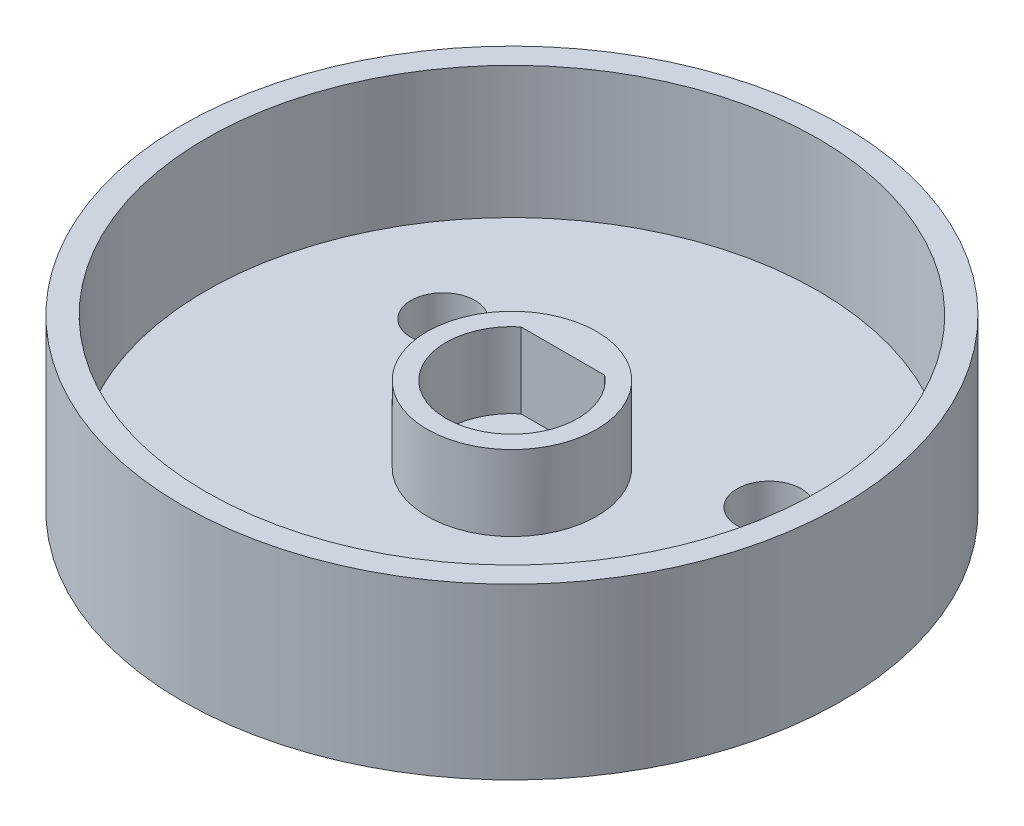
from build123d import *

# Parameters (mm, degrees)
BOSS_EXTRUDE1_DEPTH = 150
SKETCH2_R           = 35
SKETCH2_R_2         = 32.5
BOSS_EXTRUDE2_DEPTH = 14
SKETCH3_R           = 9
BOSS_EXTRUDE3_DEPTH = 8
SKETCH5_R           = 3.4
CUT_EXTRUDE1_DEPTH  = 14
CUT_EXTRUDE4_DEPTH  = 154
CUT_EXTRUDE6_START  = -4
CUT_EXTRUDE6_DEPTH  = 4
CUT_EXTRUDE7_START  = -4
CUT_EXTRUDE7_DEPTH  = 4
SKETCH13_R          = 3.4
CUT_EXTRUDE8_DEPTH  = 10
CIRPATTERN1_COUNT   = 3


with BuildPart() as part:
    # Sketch1 → Boss-Extrude1 (new body)
    with BuildSketch(Plane.YZ):
        Polygon((-60, -45), (-60, 45), (60, 45), (60, -45), (56, -45), (56, 41), (-56, 41), (-56, -45), align=None)
    extrude(amount=BOSS_EXTRUDE1_DEPTH)

    # Sketch2 → Boss-Extrude2 (add)
    with BuildSketch(Plane(origin=(0, 60, 0), x_dir=(-1, 0, 0), z_dir=(0, 1, 0))):
        with Locations(Location((-105.539679059, 0.129309752, 0), (0, 0, 270))):
            Circle(SKETCH2_R)
        with Locations(Location((-105.539679059, 0.129309752, 0), (0, 0, 90))):
            Circle(SKETCH2_R_2, mode=Mode.SUBTRACT)
    extrude(amount=BOSS_EXTRUDE2_DEPTH)

    # Sketch3 → Boss-Extrude3 (add)
    with BuildSketch(Plane(origin=(0, 60, 0), x_dir=(-1, 0, 0), z_dir=(0, 1, 0))):
        with Locations(Location((-105.539679059, 0.129309752, 0), (0, 0, 270))):
            Circle(SKETCH3_R)
        with BuildLine():
            Line((-109.989679059, -5.274161354), (-101.089679059, -5.274161354))
            ThreePointArc((-101.089679059, -5.274161354), (-105.539679059, 7.129309752), (-109.989679059, -5.274161354))
        make_face(mode=Mode.SUBTRACT)
    extrude(amount=BOSS_EXTRUDE3_DEPTH)

    # Sketch5 → Cut-Extrude1 (cut)
    with BuildSketch(Plane(origin=(0, 60, 0), x_dir=(-1, 0, 0), z_dir=(0, 1, 0))):
        with Locations(Location((-105.539679059, 0.129309752, 0), (0, 0, 90))):
            Circle(SKETCH5_R)
    extrude(amount=-CUT_EXTRUDE1_DEPTH, mode=Mode.SUBTRACT)

    # Sketch8 → Cut-Extrude4 (cut)
    with BuildSketch(Plane.YZ.offset(150)):
        Polygon((60, 35.129309752), (56, 35.129309752), (56, -34.870690248), (60, -34.870690248), (60, -45), (56, -45), (-60, -45), (-60, 45), (56, 45), (60, 45), align=None)
    extrude(amount=-CUT_EXTRUDE4_DEPTH, mode=Mode.SUBTRACT)

    # Sketch11 → Cut-Extrude6 (cut)
    with BuildSketch(Plane(origin=(0, 60, 0), x_dir=(-1, 0, 0), z_dir=(0, 1, 0)).offset(CUT_EXTRUDE6_START)):
        with BuildLine():
            Line((-150, 35.129309752), (-105.539679059, 35.129309752))
            ThreePointArc((-105.539679059, 35.129309752), (-140.539679059, 0.129309752), (-105.539679059, -34.870690248))
            Line((-105.539679059, -34.870690248), (-150, -34.870690248))
            Line((-150, -34.870690248), (-150, 35.129309752))
        make_face()
    extrude(amount=CUT_EXTRUDE6_DEPTH, mode=Mode.SUBTRACT)

    # Sketch12 → Cut-Extrude7 (cut)
    with BuildSketch(Plane(origin=(0, 60, 0), x_dir=(-1, 0, 0), z_dir=(0, 1, 0)).offset(CUT_EXTRUDE7_START)):
        with BuildLine():
            Line((-105.539679059, 35.129309752), (0, 35.129309752))
            Line((0, 35.129309752), (0, -34.870690248))
            Line((0, -34.870690248), (-105.539679059, -34.870690248))
            ThreePointArc((-105.539679059, -34.870690248), (-70.539679059, 0.129309752), (-105.539679059, 35.129309752))
        make_face()
    extrude(amount=CUT_EXTRUDE7_DEPTH, mode=Mode.SUBTRACT)

    # Sketch13 → Cut-Extrude8 (cut)
    with BuildSketch(Plane.XZ.offset(-56)):
        with Locations(Location((105.539679059, 20.129309752, 0), (0, 0, 270))):
            Circle(SKETCH13_R)
    cut_extrude8 = extrude(amount=-CUT_EXTRUDE8_DEPTH, mode=Mode.SUBTRACT)

    # CirPattern1: Cut-Extrude8 ×3 about axis
    cirpattern1_axis = Axis((105.539679059, 0, 0.129309752), (0, 1, 0))
    for i in range(1, CIRPATTERN1_COUNT):
        add(cut_extrude8.rotate(cirpattern1_axis, i * 360 / CIRPATTERN1_COUNT), mode=Mode.SUBTRACT)


solid = part.part
